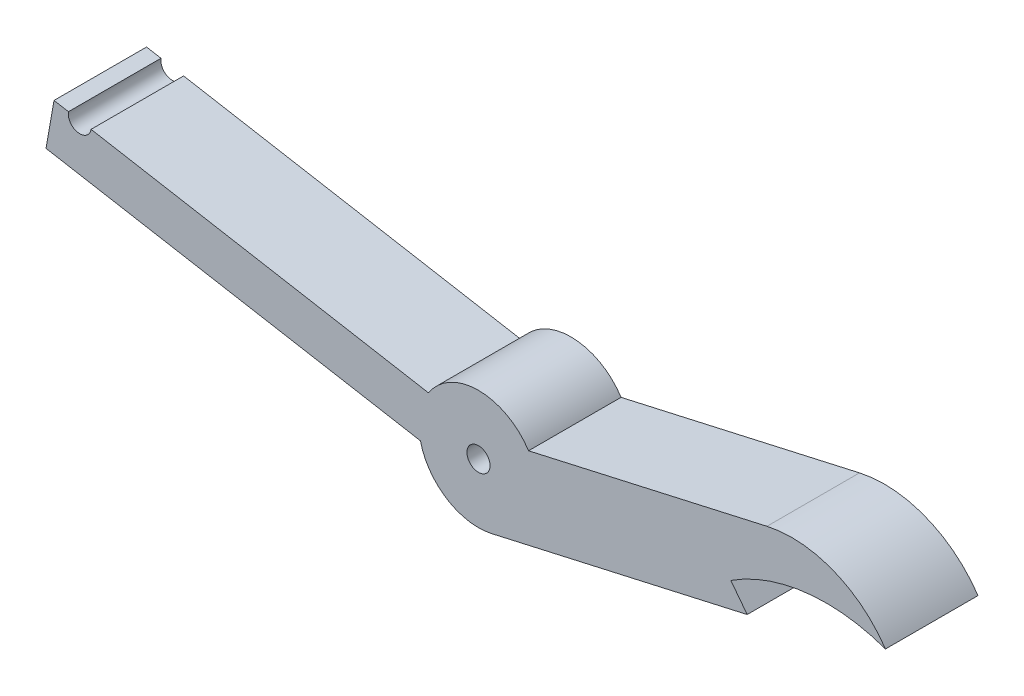
from build123d import *

# Parameters (mm, degrees)
SKETCH1_R           = 1.5875
BOSS_EXTRUDE1_DEPTH = 6.35


with BuildPart() as part:
    # Sketch1 → Boss-Extrude1 (new, symmetric)
    with BuildSketch(Plane.XY):
        with BuildLine():
            Line((-6.857967121, 4.433224129), (-53.175519737, 12.600258336))
            ThreePointArc((-53.175519737, 12.600258336), (-54.999856137, 11.322844236), (-56.277270236, 13.147180636))
            Line((-56.277270236, 13.147180636), (-58.257319182, 13.496316688))
            Line((-58.257319182, 13.496316688), (-59.35998511, 7.242787457))
            Line((-59.35998511, 7.242787457), (-7.960633049, -1.820305103))
            ThreePointArc((-7.960633049, -1.820305103), (-4.365043482, -6.901563925), (1.766856325, -7.9726663))
            Line((1.766856325, -7.9726663), (36.881050722, -0.047144418))
            Line((36.881050722, -0.047144418), (34.635185978, 2.889025961))
            ThreePointArc((34.635185978, 2.889025961), (44.961162175, 6.595254431), (55.860821822, 5.346521684))
            ThreePointArc((55.860821822, 5.346521684), (48.726273767, 11.088641723), (39.595789676, 11.801367988))
            Line((39.595789676, 11.801367988), (6.869791404, 4.414878852))
            ThreePointArc((6.869791404, 4.414878852), (0.010912869, 8.166092708), (-6.857967121, 4.433224129))
        make_face()
        Circle(SKETCH1_R, mode=Mode.SUBTRACT)
    extrude(amount=BOSS_EXTRUDE1_DEPTH, both=True)


solid = part.part
